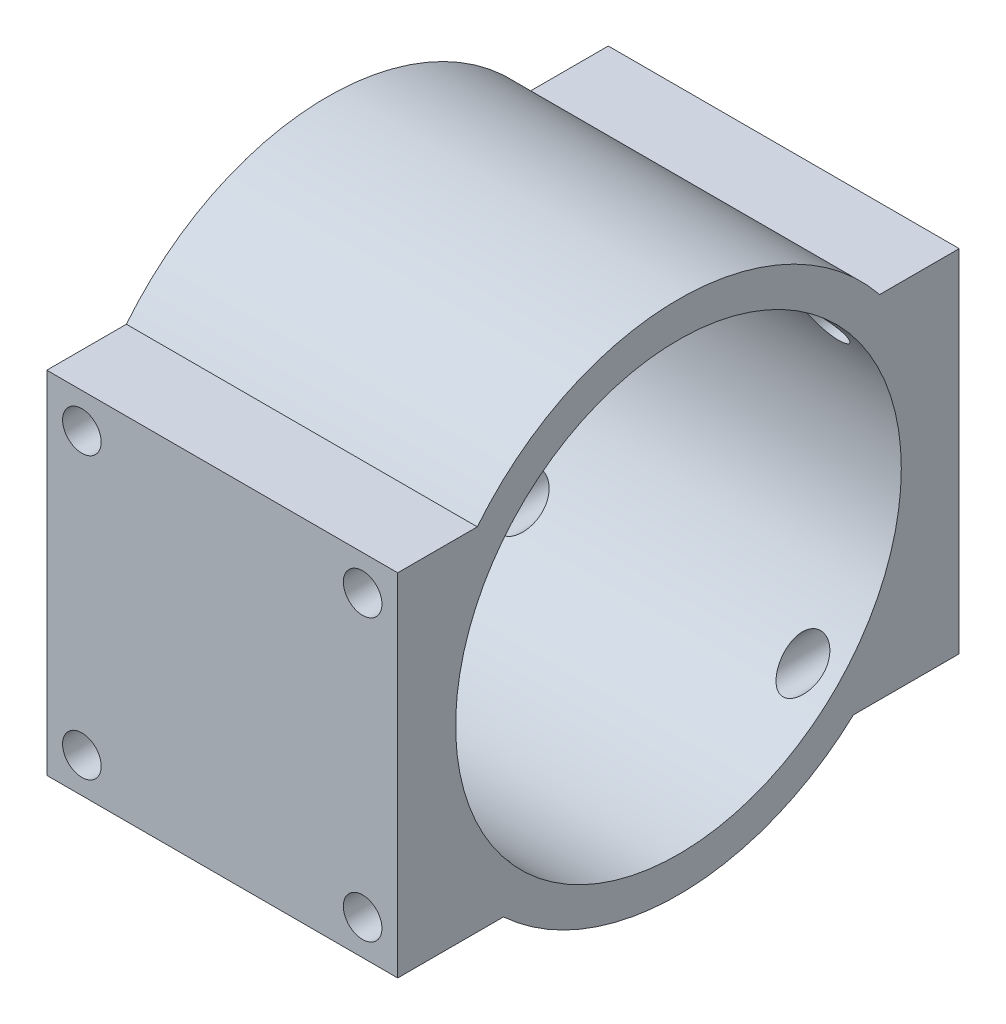
from build123d import *

# Parameters (mm, degrees)
SKETCH1_W               = 50
SKETCH1_H               = 50
SKETCH1_R               = 2.75
BOSS_EXTRUDE1_DEPTH     = 40
CUT_EXTRUDE1_DEPTH      = 55.350712967
CUT_EXTRUDE1_DEPTH_BACK = 55.350712967
SKETCH2_R               = 31.75
BOSS_EXTRUDE2_DEPTH     = 50
CUT_EXTRUDE2_DEPTH      = 50
CUT_EXTRUDE2_DEPTH_BACK = 60.796007501
SKETCH1_2_R             = 2.75
BOSS_EXTRUDE3_START     = -40
SKETCH1_3_W             = 50
SKETCH1_3_H             = 50
SKETCH1_3_R             = 2.75
BOSS_EXTRUDE3_DEPTH     = 40
CUT_EXTRUDE3_DEPTH      = 74.827925055
SCALE1_SCALE            = 1.015


with BuildPart() as part:
    # Sketch1 → Boss-Extrude1 (new body)
    with BuildSketch(Plane.XY):
        with Locations((0, -2)):
            Rectangle(SKETCH1_W, SKETCH1_H)
        with Locations((-20, 18)):
            Circle(SKETCH1_R, mode=Mode.SUBTRACT)
        with Locations((20, 18)):
            Circle(SKETCH1_R, mode=Mode.SUBTRACT)
        with Locations((20, -22)):
            Circle(SKETCH1_R, mode=Mode.SUBTRACT)
        with Locations((-20, -22)):
            Circle(SKETCH1_R, mode=Mode.SUBTRACT)
    extrude(amount=BOSS_EXTRUDE1_DEPTH)

    # Sketch2 → Cut-Extrude1 (cut, two sides: drawn at the far end of the back side and taken through both)
    with BuildSketch(Plane(origin=(0, 0, 0), x_dir=(0, 0, -1), z_dir=(1, 0, 0)).offset(-CUT_EXTRUDE1_DEPTH_BACK)):
        Circle(SKETCH2_R)
    extrude(amount=CUT_EXTRUDE1_DEPTH + CUT_EXTRUDE1_DEPTH_BACK, mode=Mode.SUBTRACT)

    # Sketch3 → Boss-Extrude2 (add)
    with BuildSketch(Plane(origin=(25, 0, 0), x_dir=(0, 0, -1), z_dir=(1, 0, 0))):
        with BuildLine():
            ThreePointArc((-25.334346262, 26.622047244), (36.554180512, 3.788718396), (-19.33589834, -31.251968504))
            ThreePointArc((-19.33589834, -31.251968504), (-36.554180512, -3.788718396), (-25.334346262, 26.622047244))
        make_face()
        with BuildLine():
            ThreePointArc((-21.887496431, 23), (-31.580822619, -3.273246506), (-16.705163872, -27))
            ThreePointArc((-16.705163872, -27), (31.580822619, 3.273246506), (-21.887496431, 23))
        make_face(mode=Mode.SUBTRACT)
    extrude(amount=-BOSS_EXTRUDE2_DEPTH)

    # Sketch1<2> → Cut-Extrude2 (cut, two sides: drawn at the far end of the back side and taken through both)
    with BuildSketch(Plane.XY.offset(-CUT_EXTRUDE2_DEPTH_BACK)):
        with Locations((-20, 18)):
            Circle(SKETCH1_2_R)
        with Locations((20, 18)):
            Circle(SKETCH1_2_R)
        with Locations((20, -22)):
            Circle(SKETCH1_2_R)
        with Locations((-20, -22)):
            Circle(SKETCH1_2_R)
    extrude(amount=CUT_EXTRUDE2_DEPTH + CUT_EXTRUDE2_DEPTH_BACK, mode=Mode.SUBTRACT)

    # Sketch1<3> → Boss-Extrude3 (add)
    with BuildSketch(Plane.XY.offset(BOSS_EXTRUDE3_START)):
        with Locations((0, -2)):
            Rectangle(SKETCH1_3_W, SKETCH1_3_H)
        with Locations((-20, 18)):
            Circle(SKETCH1_3_R, mode=Mode.SUBTRACT)
        with Locations((20, 18)):
            Circle(SKETCH1_3_R, mode=Mode.SUBTRACT)
        with Locations((20, -22)):
            Circle(SKETCH1_3_R, mode=Mode.SUBTRACT)
        with Locations((-20, -22)):
            Circle(SKETCH1_3_R, mode=Mode.SUBTRACT)
    extrude(amount=BOSS_EXTRUDE3_DEPTH)

    # Sketch3<2> → Cut-Extrude3 (cut, through all)
    with BuildSketch(Plane(origin=(25, 0, 0), x_dir=(0, 0, -1), z_dir=(1, 0, 0))):
        with BuildLine():
            ThreePointArc((-16.705163872, -27), (31.580822619, 3.273246506), (-21.887496431, 23))
            ThreePointArc((-21.887496431, 23), (-31.580822619, -3.273246506), (-16.705163872, -27))
        make_face()
    extrude(amount=-CUT_EXTRUDE3_DEPTH, mode=Mode.SUBTRACT)


with BuildPart() as part_1:
    # Scale1: scaled about (1.4e-07, -1.441249933, -1.267e-05)
    add(part.part.scale(SCALE1_SCALE).moved(Location((-2e-09, 0.021618749, 1.9e-07))))


solid = part_1.part
